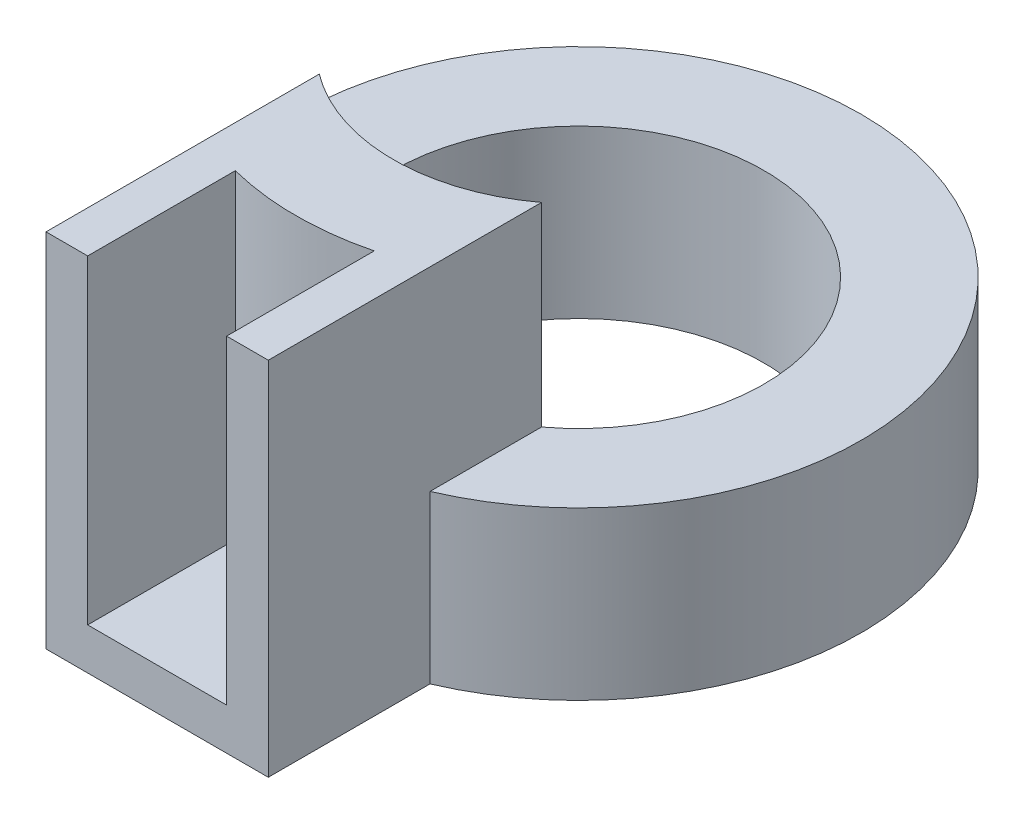
from build123d import *

# Parameters (mm, degrees)
SKETCH1_R                            = 20.334999999999997
SKETCH1_R_2                          = 13.334999999999999
BOSS_EXTRUDE1_DEPTH                  = 12
BOSS_EXTRUDE2_DEPTH                  = 10
BOSS_EXTRUDE2_DIRECTION_2_REACH      = 49.027
BOSS_EXTRUDE2_DIRECTION_2_END_RADIUS = 13.334999999999999
CUT_EXTRUDE1_REACH                   = 62.473
CUT_EXTRUDE1_END_RADIUS              = 20.334999999999997
BOSS_EXTRUDE3_DEPTH                  = 11


with BuildPart() as part:
    # Sketch1 → Boss-Extrude1 (new body)
    with BuildSketch(Plane(origin=(0, 0, 0), x_dir=(1, 0, 0), z_dir=(0, 1, 0))):
        with Locations(Location((0, 0, 0), (0, 0, 270))):
            Circle(SKETCH1_R)
        with Locations(Location((0, 0, 0), (0, 0, 270))):
            Circle(SKETCH1_R_2, mode=Mode.SUBTRACT)
    extrude(amount=BOSS_EXTRUDE1_DEPTH)

    # Sketch2 → Boss-Extrude2 (add)
    with BuildSketch(Plane.XY.offset(20.334999999999997)):
        Polygon((-8, 26.000000000000004), (-7.9999999999999964, 0), (8.000000000000004, 0), (8, 26.000000000000004), align=None)
        Polygon((-5.000000000000001, 23.000000000000004), (5, 23.000000000000004), (4.999999999999998, 3), (-4.999999999999998, 3), align=None, mode=Mode.SUBTRACT)
    extrude(amount=BOSS_EXTRUDE2_DEPTH)

    # Boss-Extrude2 direction 2: up to this cylinder (the profile starts outside it)
    boss_extrude2_direction_2_end = Plane(origin=(0, 13, 0), z_dir=(0, -1, 0)) * Cylinder(BOSS_EXTRUDE2_DIRECTION_2_END_RADIUS, 125.724, mode=Mode.PRIVATE)
    # Sketch2 → Boss-Extrude2 direction 2 (add, up to the surface)
    with BuildSketch(Plane.XY.offset(20.334999999999997), mode=Mode.PRIVATE) as boss_extrude2_direction_2_sk1:
        Polygon((-8, 26.000000000000004), (-7.9999999999999964, 0), (8.000000000000004, 0), (8, 26.000000000000004), align=None)
        Polygon((-5.000000000000001, 23.000000000000004), (5, 23.000000000000004), (4.999999999999998, 3), (-4.999999999999998, 3), align=None, mode=Mode.SUBTRACT)
    boss_extrude2_direction_2_tool1 = extrude(boss_extrude2_direction_2_sk1.sketch, amount=-BOSS_EXTRUDE2_DIRECTION_2_REACH, mode=Mode.PRIVATE) - boss_extrude2_direction_2_end
    add(boss_extrude2_direction_2_tool1.solids().sort_by_distance((-7.694713, 13, 20.335))[0])

    # Cut-Extrude1: up to this cylinder (the profile starts outside it)
    cut_extrude1_end = Plane(origin=(0, 24.5, 0), z_dir=(0, -1, 0)) * Cylinder(CUT_EXTRUDE1_END_RADIUS, 166.61599999999999, mode=Mode.PRIVATE)
    # Sketch3 → Cut-Extrude1 (cut, up to the surface)
    with BuildSketch(Plane.XY.offset(30.335), mode=Mode.PRIVATE) as cut_extrude1_sk1:
        Polygon((-5.000000000000002, 26.000000000000004), (4.999999999999997, 26.000000000000004), (4.999999999999997, 23.000000000000004), (-5.000000000000001, 23.000000000000004), align=None)
    cut_extrude1_tool1 = extrude(cut_extrude1_sk1.sketch, amount=-CUT_EXTRUDE1_REACH, mode=Mode.PRIVATE) - cut_extrude1_end
    add(cut_extrude1_tool1.solids().sort_by_distance((0, 24.5, 30.335))[0], mode=Mode.SUBTRACT)

    # Sketch4 → Boss-Extrude3 (add)
    with BuildSketch(Plane(origin=(0, 12, 0), x_dir=(1, 0, 0), z_dir=(0, 1, 0))):
        with BuildLine():
            Line((4.999999999999998, -19.710713457406865), (4.9999999999999964, -12.362128659741414))
            ThreePointArc((4.9999999999999964, -12.362128659741414), (-2.14e-15, -13.335), (-5.000000000000001, -12.362128659741412))
            Line((-5.000000000000001, -12.362128659741412), (-5.000000000000008, -19.710713457406865))
            ThreePointArc((-5.000000000000008, -19.710713457406865), (-7.79e-15, -20.335000000000004), (4.999999999999998, -19.710713457406865))
        make_face()
    extrude(amount=BOSS_EXTRUDE3_DEPTH)


solid = part.part
